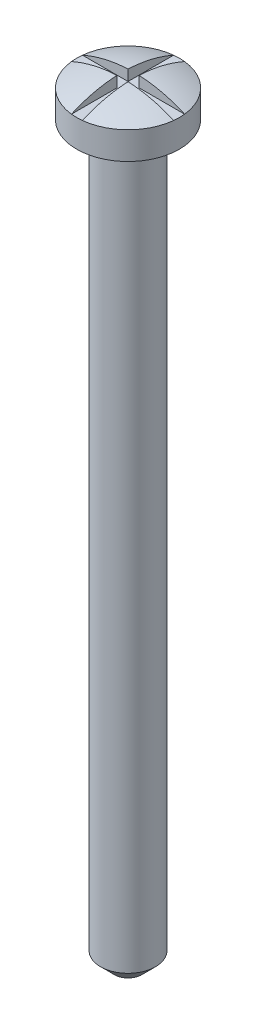
from build123d import *

# Parameters (mm, degrees)
WYTNIJ_WYCI_GNI_CIE1_START = -5
SZKIC2_W                   = 0.6
SZKIC2_H                   = 0.6
WYTNIJ_WYCI_GNI_CIE1_DEPTH = 3.5
SFAZOWANIE1_SIZE           = 0.75


with BuildPart() as part:
    # Szkic1 → Obrót1 (revolve)
    with BuildSketch(Plane.XY, mode=Mode.PRIVATE) as obr_t1_sk:
        with BuildLine():
            Line((0, 0), (-1.5, 0))
            Line((-1.5, 0), (-1.5, 40))
            Line((-1.5, 40), (-2.8, 40))
            Line((-2.8, 40), (-2.8, 41.5))
            ThreePointArc((-2.8, 41.5), (-1.431782106, 41.948316496), (0, 42.1))
            Line((0, 42.1), (0, 0))
        make_face()
    revolve(obr_t1_sk.sketch.rotate(Axis((0, 0, 0), (0, 1, 0)), 180), axis=Axis((0, 0, 0), (0, 1, 0)))

    # Szkic2 → Wytnij-wyciągnięcie1 (cut)
    with BuildSketch(Plane.XZ.offset(-40).offset(WYTNIJ_WYCI_GNI_CIE1_START)):
        with BuildLine():
            Line((0.3, -0.3), (-0.3, -0.3))
            Line((-0.3, -0.3), (-0.3, -1.469693846))
            ThreePointArc((-0.3, -1.469693846), (0, -1.5), (0.3, -1.469693846))
            Line((0.3, -1.469693846), (0.3, -0.3))
        make_face()
        with BuildLine():
            Line((-0.3, -0.3), (-0.3, 0.3))
            Line((-0.3, 0.3), (-1.469693846, 0.3))
            ThreePointArc((-1.469693846, 0.3), (-1.5, 0), (-1.469693846, -0.3))
            Line((-1.469693846, -0.3), (-0.3, -0.3))
        make_face()
        with BuildLine():
            ThreePointArc((0.3, 1.469693846), (0, 1.5), (-0.3, 1.469693846))
            Line((-0.3, 1.469693846), (-0.3, 0.3))
            Line((-0.3, 0.3), (0.3, 0.3))
            Line((0.3, 0.3), (0.3, 1.469693846))
        make_face()
        with BuildLine():
            ThreePointArc((0.3, 2.783882181), (0.150216331, 2.795967642), (0, 2.8))
            ThreePointArc((0, 2.8), (-0.150216331, 2.795967642), (-0.3, 2.783882181))
            Line((-0.3, 2.783882181), (-0.3, 1.469693846))
            ThreePointArc((-0.3, 1.469693846), (0, 1.5), (0.3, 1.469693846))
            Line((0.3, 1.469693846), (0.3, 2.783882181))
        make_face()
        with BuildLine():
            ThreePointArc((0.3, -1.469693846), (0, -1.5), (-0.3, -1.469693846))
            Line((-0.3, -1.469693846), (-0.3, -2.783882181))
            ThreePointArc((-0.3, -2.783882181), (-0.150216331, -2.795967642), (0, -2.8))
            ThreePointArc((0, -2.8), (0.150216331, -2.795967642), (0.3, -2.783882181))
            Line((0.3, -2.783882181), (0.3, -1.469693846))
        make_face()
        with BuildLine():
            Line((-1.469693846, 0.3), (-2.783882181, 0.3))
            ThreePointArc((-2.783882181, 0.3), (-2.795967642, 0.150216331), (-2.8, 0))
            ThreePointArc((-2.8, 0), (-2.795967642, -0.150216331), (-2.783882181, -0.3))
            Line((-2.783882181, -0.3), (-1.469693846, -0.3))
            ThreePointArc((-1.469693846, -0.3), (-1.5, 0), (-1.469693846, 0.3))
        make_face()
        with BuildLine():
            ThreePointArc((2.8, 0), (2.795967642, 0.150216331), (2.783882181, 0.3))
            Line((2.783882181, 0.3), (1.469693846, 0.3))
            ThreePointArc((1.469693846, 0.3), (1.49240423, 0.150763443), (1.5, 0))
            ThreePointArc((1.5, 0), (1.49240423, -0.150763443), (1.469693846, -0.3))
            Line((1.469693846, -0.3), (2.783882181, -0.3))
            ThreePointArc((2.783882181, -0.3), (2.795967642, -0.150216331), (2.8, 0))
        make_face()
        with BuildLine():
            Line((1.469693846, 0.3), (0.3, 0.3))
            Line((0.3, 0.3), (0.3, -0.3))
            Line((0.3, -0.3), (1.469693846, -0.3))
            ThreePointArc((1.469693846, -0.3), (1.49240423, -0.150763443), (1.5, 0))
            ThreePointArc((1.5, 0), (1.49240423, 0.150763443), (1.469693846, 0.3))
        make_face()
        Rectangle(SZKIC2_W, SZKIC2_H)
    extrude(amount=WYTNIJ_WYCI_GNI_CIE1_DEPTH, mode=Mode.SUBTRACT)

    # Sfazowanie1
    sfazowanie1_edges = [part.edges().sort_by_distance(p)[0] for p in [
        (-1.5, 0, 0),
    ]]
    chamfer(sfazowanie1_edges, length=SFAZOWANIE1_SIZE)


solid = part.part
